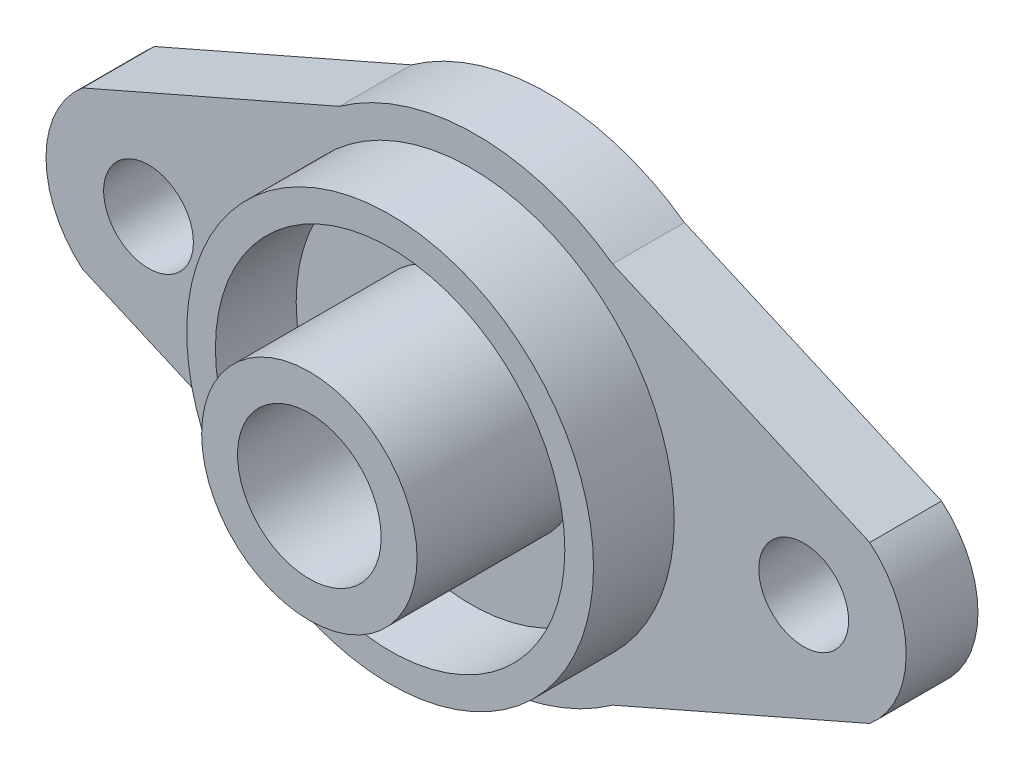
from build123d import *

# Parameters (mm, degrees)
EXTRUDE_1_DEPTH       = 4
HOLE_WIZARD_5_0_5_1_D = 5
SKETCH_4_R            = 11.330923122
EXTRUDE_2_DEPTH       = 4.5
SKETCH_5_R            = 9.73271474
CUT_EXTRUDE_1_DEPTH   = 4.5
SKETCH_6_R            = 6
EXTRUDE_3_DEPTH       = 9
SKETCH_7_R            = 4
CUT_EXTRUDE_2_DEPTH   = 47.064049502


with BuildPart() as part:
    # 草图1 → 凸台-拉伸1 (new body)
    with BuildSketch(Plane.XY):
        with BuildLine():
            Line((-3.679866613, 4.367396682), (10.641275218, 10.64119661))
            ThreePointArc((10.641275218, 10.64119661), (18.25, 13.081580872), (25.858724782, 10.64119661))
            Line((25.858724782, 10.64119661), (40.179866613, 4.367396682))
            ThreePointArc((40.179866613, 4.367396682), (42.21100447, 0), (40.179866613, -4.367396682))
            Line((40.179866613, -4.367396682), (25.858724782, -10.64119661))
            ThreePointArc((25.858724782, -10.64119661), (18.25, -13.081580872), (10.641275218, -10.64119661))
            Line((10.641275218, -10.64119661), (-3.679866613, -4.367396682))
            ThreePointArc((-3.679866613, -4.367396682), (-5.71100447, 0), (-3.679866613, 4.367396682))
        make_face()
    extrude(amount=EXTRUDE_1_DEPTH)

    # Ø5.0 (5) 直径孔1 (through all)
    with Locations(Plane.XY.offset(4)):
        with Locations((0, 0), (36.5, 0)):
            Hole(HOLE_WIZARD_5_0_5_1_D / 2)

    # 草图4 → 凸台-拉伸2 (add)
    with BuildSketch(Plane.XY.offset(4)):
        with Locations((17.959725488, 0)):
            Circle(SKETCH_4_R)
    extrude(amount=EXTRUDE_2_DEPTH)

    # 草图5 → 切除-拉伸1 (cut)
    with BuildSketch(Plane.XY.offset(8.5)):
        with Locations((17.959725488, 0)):
            Circle(SKETCH_5_R)
    extrude(amount=-CUT_EXTRUDE_1_DEPTH, mode=Mode.SUBTRACT)

    # 草图6 → 凸台-拉伸3 (add)
    with BuildSketch(Plane.XY.offset(4)):
        with Locations((17.959725488, 0)):
            Circle(SKETCH_6_R)
    extrude(amount=EXTRUDE_3_DEPTH)

    # 草图7 → 切除-拉伸2 (cut, through all)
    with BuildSketch(Plane.XY.offset(13)):
        with Locations((17.959725488, 0)):
            Circle(SKETCH_7_R)
    extrude(amount=-CUT_EXTRUDE_2_DEPTH, mode=Mode.SUBTRACT)


solid = part.part
